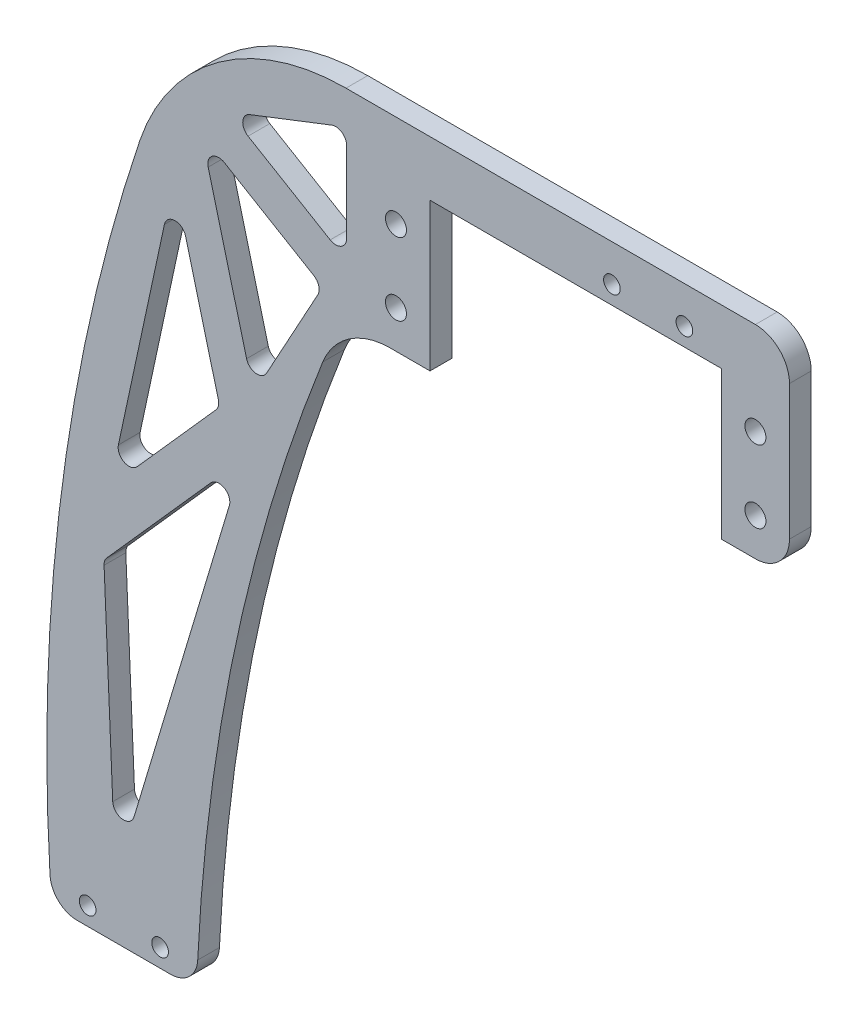
from build123d import *

# Parameters (mm, degrees)
BOSS_EXTRU_1_DEPTH      = 3
ENL_V_MAT_EXTRU_1_REACH = 128.289
ESQUISSE2_W             = 40.2
ESQUISSE2_H             = 20.4
ENL_V_MAT_EXTRU_2_REACH = 128.289
ESQUISSE3_R             = 1.45
CONG_2_R                = 4.7
CONG_3_R                = 10
CONG_4_R                = 30
CONG_5_R                = 3.75
ENL_V_MAT_EXTRU_3_REACH = 128.289
CONG_6_R                = 1.5
ENL_V_MAT_EXTRU_4_REACH = 128.289
ESQUISSE5_R             = 1.15
ESQUISSE6_R             = 1.15
ENL_V_MAT_EXTRU_5_DEPTH = 10


with BuildPart() as part:
    # Esquisse1 → Boss.-Extru.1 (new body)
    with BuildSketch(Plane.XY):
        with BuildLine():
            Line((-30.9, 14), (-50.9, 14))
            ThreePointArc((-50.9, 14), (-68.065443638, -43.785518027), (-70.9, -104))
            Line((-70.9, -104), (-50.9, -104))
            ThreePointArc((-50.9, -104), (-45.084672315, -58.070072819), (-30.9, -14))
            Line((-30.9, -14), (30.9, -14))
            Line((30.9, -14), (30.9, 14))
            Line((30.9, 14), (-30.9, 14))
        make_face()
    extrude(amount=BOSS_EXTRU_1_DEPTH)

    # Esquisse2 → Enlèv. mat.-Extru.1 (cut, up to next)
    with BuildSketch(Plane.XY.offset(3), mode=Mode.PRIVATE) as enl_v_mat_extru_1_sk1:
        with Locations((1.4, -3.8)):
            Rectangle(ESQUISSE2_W, ESQUISSE2_H)
    enl_v_mat_extru_1_tool1 = extrude(enl_v_mat_extru_1_sk1.sketch, amount=-ENL_V_MAT_EXTRU_1_REACH, mode=Mode.PRIVATE) & part.part
    add(enl_v_mat_extru_1_tool1.solids().sort_by_distance((1.4, -3.8, 3))[0], mode=Mode.SUBTRACT)

    # Esquisse3 → Enlèv. mat.-Extru.2 (cut, up to next)
    with BuildSketch(Plane.XY.offset(3), mode=Mode.PRIVATE) as enl_v_mat_extru_2_sk1:
        with Locations((26.2, -8.8)):
            Circle(ESQUISSE3_R)
    enl_v_mat_extru_2_tool1 = extrude(enl_v_mat_extru_2_sk1.sketch, amount=-ENL_V_MAT_EXTRU_2_REACH, mode=Mode.PRIVATE) & part.part
    # Esquisse3 → Enlèv. mat.-Extru.2 (cut, up to next)
    with BuildSketch(Plane.XY.offset(3), mode=Mode.PRIVATE) as enl_v_mat_extru_2_sk2:
        with Locations((-23.4, -8.8)):
            Circle(ESQUISSE3_R)
    enl_v_mat_extru_2_tool2 = extrude(enl_v_mat_extru_2_sk2.sketch, amount=-ENL_V_MAT_EXTRU_2_REACH, mode=Mode.PRIVATE) & part.part
    # Esquisse3 → Enlèv. mat.-Extru.2 (cut, up to next)
    with BuildSketch(Plane.XY.offset(3), mode=Mode.PRIVATE) as enl_v_mat_extru_2_sk3:
        with Locations((-23.4, 1.2)):
            Circle(ESQUISSE3_R)
    enl_v_mat_extru_2_tool3 = extrude(enl_v_mat_extru_2_sk3.sketch, amount=-ENL_V_MAT_EXTRU_2_REACH, mode=Mode.PRIVATE) & part.part
    # Esquisse3 → Enlèv. mat.-Extru.2 (cut, up to next)
    with BuildSketch(Plane.XY.offset(3), mode=Mode.PRIVATE) as enl_v_mat_extru_2_sk4:
        with Locations((26.2, 1.2)):
            Circle(ESQUISSE3_R)
    enl_v_mat_extru_2_tool4 = extrude(enl_v_mat_extru_2_sk4.sketch, amount=-ENL_V_MAT_EXTRU_2_REACH, mode=Mode.PRIVATE) & part.part
    add(enl_v_mat_extru_2_tool1.solids().sort_by_distance((26.2, -8.8, 3))[0], mode=Mode.SUBTRACT)
    add(enl_v_mat_extru_2_tool2.solids().sort_by_distance((-23.4, -8.8, 3))[0], mode=Mode.SUBTRACT)
    add(enl_v_mat_extru_2_tool3.solids().sort_by_distance((-23.4, 1.2, 3))[0], mode=Mode.SUBTRACT)
    add(enl_v_mat_extru_2_tool4.solids().sort_by_distance((26.2, 1.2, 3))[0], mode=Mode.SUBTRACT)

    # Congé2
    cong_2_edges = [part.edges().sort_by_distance(p)[0] for p in [
        (30.9, -14, 1.5),
        (30.9, 14, 1.5),
    ]]
    fillet(cong_2_edges, radius=CONG_2_R)

    # Congé3
    cong_3_edges = [part.edges().sort_by_distance(p)[0] for p in [
        (-30.9, -14, 1.5),
    ]]
    fillet(cong_3_edges, radius=CONG_3_R)

    # Congé4
    cong_4_edges = [part.edges().sort_by_distance(p)[0] for p in [
        (-50.9, 14, 1.5),
    ]]
    fillet(cong_4_edges, radius=CONG_4_R)

    # Congé5
    cong_5_edges = [part.edges().sort_by_distance(p)[0] for p in [
        (-50.9, -104, 1.5),
        (-70.9, -104, 1.5),
    ]]
    fillet(cong_5_edges, radius=CONG_5_R)

    # Esquisse4 → Enlèv. mat.-Extru.3 (cut, up to next)
    with BuildSketch(Plane.XY.offset(3), mode=Mode.PRIVATE) as enl_v_mat_extru_3_sk1:
        Polygon((-33.484388558, -11.358463284), (-43.05887194, -28.83955138), (-50.238359759, -1.41390105), align=None)
    enl_v_mat_extru_3_tool1 = extrude(enl_v_mat_extru_3_sk1.sketch, amount=-ENL_V_MAT_EXTRU_3_REACH, mode=Mode.PRIVATE) & part.part
    # Esquisse4 → Enlèv. mat.-Extru.3 (cut, up to next)
    with BuildSketch(Plane.XY.offset(3), mode=Mode.PRIVATE) as enl_v_mat_extru_3_sk2:
        Polygon((-54.025759835, -8.664001443), (-47.704691317, -32.810489222), (-62.900626013, -49.913479621), align=None)
    enl_v_mat_extru_3_tool2 = extrude(enl_v_mat_extru_3_sk2.sketch, amount=-ENL_V_MAT_EXTRU_3_REACH, mode=Mode.PRIVATE) & part.part
    # Esquisse4 → Enlèv. mat.-Extru.3 (cut, up to next)
    with BuildSketch(Plane.XY.offset(3), mode=Mode.PRIVATE) as enl_v_mat_extru_3_sk3:
        Polygon((-44.434019708, -37.409998289), (-63.702500518, -59.0966302), (-62.097933842, -96.225533823), align=None)
    enl_v_mat_extru_3_tool3 = extrude(enl_v_mat_extru_3_sk3.sketch, amount=-ENL_V_MAT_EXTRU_3_REACH, mode=Mode.PRIVATE) & part.part
    # Esquisse4 → Enlèv. mat.-Extru.3 (cut, up to next)
    with BuildSketch(Plane.XY.offset(3), mode=Mode.PRIVATE) as enl_v_mat_extru_3_sk4:
        Polygon((-46.457316631, 3.078230456), (-30.208699652, -6.566371461), (-30.208699652, 9.392706582), align=None)
    enl_v_mat_extru_3_tool4 = extrude(enl_v_mat_extru_3_sk4.sketch, amount=-ENL_V_MAT_EXTRU_3_REACH, mode=Mode.PRIVATE) & part.part
    add(enl_v_mat_extru_3_tool1.solids().sort_by_distance((-42.26054, -13.870639, 3))[0], mode=Mode.SUBTRACT)
    add(enl_v_mat_extru_3_tool2.solids().sort_by_distance((-54.877026, -30.462657, 3))[0], mode=Mode.SUBTRACT)
    add(enl_v_mat_extru_3_tool3.solids().sort_by_distance((-56.744818, -64.244054, 3))[0], mode=Mode.SUBTRACT)
    add(enl_v_mat_extru_3_tool4.solids().sort_by_distance((-35.624905, 1.968189, 3))[0], mode=Mode.SUBTRACT)

    # Congé6
    cong_6_edges = [part.edges().sort_by_distance(p)[0] for p in [
        (-62.900626013, -49.913479621, 1.5),
        (-54.025759835, -8.664001443, 1.5),
        (-47.704691317, -32.810489222, 1.5),
        (-46.457316631, 3.078230456, 1.5),
        (-30.208699652, 9.392706582, 1.5),
        (-30.208699652, -6.566371461, 1.5),
        (-44.434019708, -37.409998289, 1.5),
        (-62.097933842, -96.225533823, 1.5),
        (-63.702500518, -59.0966302, 1.5),
        (-50.238359759, -1.41390105, 1.5),
        (-33.484388558, -11.358463284, 1.5),
        (-43.05887194, -28.83955138, 1.5),
    ]]
    fillet(cong_6_edges, radius=CONG_6_R)

    # Esquisse5 → Enlèv. mat.-Extru.4 (cut, up to next)
    with BuildSketch(Plane.XY.offset(3), mode=Mode.PRIVATE) as enl_v_mat_extru_4_sk1:
        with Locations((16.4, 8.9)):
            Circle(ESQUISSE5_R)
    enl_v_mat_extru_4_tool1 = extrude(enl_v_mat_extru_4_sk1.sketch, amount=-ENL_V_MAT_EXTRU_4_REACH, mode=Mode.PRIVATE) & part.part
    # Esquisse5 → Enlèv. mat.-Extru.4 (cut, up to next)
    with BuildSketch(Plane.XY.offset(3), mode=Mode.PRIVATE) as enl_v_mat_extru_4_sk2:
        with Locations((6.4, 8.9)):
            Circle(ESQUISSE5_R)
    enl_v_mat_extru_4_tool2 = extrude(enl_v_mat_extru_4_sk2.sketch, amount=-ENL_V_MAT_EXTRU_4_REACH, mode=Mode.PRIVATE) & part.part
    add(enl_v_mat_extru_4_tool1.solids().sort_by_distance((16.4, 8.9, 3))[0], mode=Mode.SUBTRACT)
    add(enl_v_mat_extru_4_tool2.solids().sort_by_distance((6.4, 8.9, 3))[0], mode=Mode.SUBTRACT)

    # Esquisse6 → Enlèv. mat.-Extru.5 (cut)
    with BuildSketch(Plane.XY.offset(3)):
        with Locations((-65.945726783, -101.5)):
            Circle(ESQUISSE6_R)
        with Locations((-55.945726783, -101.5)):
            Circle(ESQUISSE6_R)
    extrude(amount=-ENL_V_MAT_EXTRU_5_DEPTH, mode=Mode.SUBTRACT)


solid = part.part
